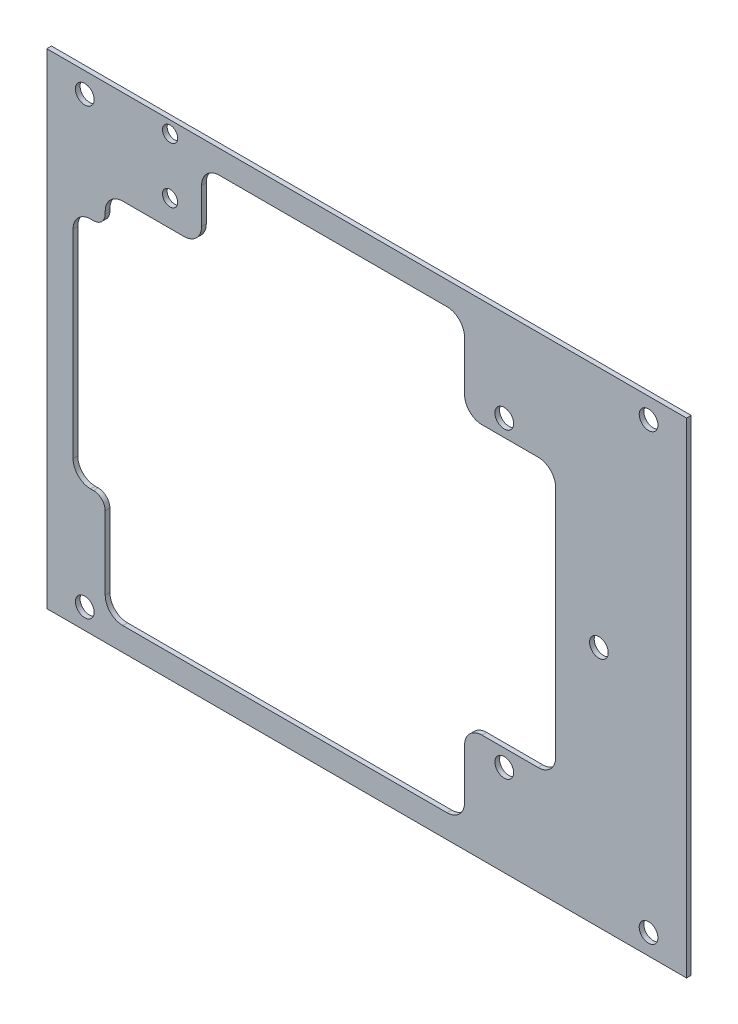
from build123d import *

# Parameters (mm, degrees)
SKETCH1_W           = 109.5
SKETCH1_H           = 83
SKETCH1_R           = 1.6
SKETCH1_R_2         = 1.3
BOSS_EXTRUDE1_DEPTH = 0.8
FILLET1_R           = 3
FILLET2_R           = 2


with BuildPart() as part:
    # Sketch1 → Boss-Extrude1 (new body)
    with BuildSketch(Plane.XY):
        with Locations((0, -41.5)):
            Rectangle(SKETCH1_W, SKETCH1_H)
        with Locations((23.55, -67.375)):
            Circle(SKETCH1_R, mode=Mode.SUBTRACT)
        with Locations((23.55, -15.625)):
            Circle(SKETCH1_R, mode=Mode.SUBTRACT)
        with Locations((48.25, -3.5)):
            Circle(SKETCH1_R, mode=Mode.SUBTRACT)
        with Locations((48.25, -79.5)):
            Circle(SKETCH1_R, mode=Mode.SUBTRACT)
        with Locations((-48.25, -79.5)):
            Circle(SKETCH1_R, mode=Mode.SUBTRACT)
        with Locations((-48.25, -3.5)):
            Circle(SKETCH1_R, mode=Mode.SUBTRACT)
        with Locations((-33.65, -2.07)):
            Circle(SKETCH1_R_2, mode=Mode.SUBTRACT)
        with Locations((-33.65, -11.6)):
            Circle(SKETCH1_R_2, mode=Mode.SUBTRACT)
        with Locations((39.75, -41.5)):
            Circle(SKETCH1_R, mode=Mode.SUBTRACT)
        Polygon((-50.25, -41.5), (-50.25, -61.5), (-44.75, -61.5), (-44.75, -79), (16.75, -79), (16.75, -64.5), (32.35, -64.5), (32.35, -18.5), (16.75, -18.5), (16.75, -4), (-28.25, -4), (-28.25, -16.1), (-44.75, -16.1), (-44.75, -21.5), (-50.25, -21.5), align=None, mode=Mode.SUBTRACT)
    extrude(amount=BOSS_EXTRUDE1_DEPTH)

    # Fillet1
    fillet1_edges = [part.edges().sort_by_distance(p)[0] for p in [
        (32.35, -64.5, 0.4),
        (32.35, -18.5, 0.4),
        (16.75, -18.5, 0.4),
        (16.75, -4, 0.4),
        (-28.25, -4, 0.4),
        (-28.25, -16.1, 0.4),
        (-44.75, -16.1, 0.4),
        (-50.25, -21.5, 0.4),
        (-50.25, -61.5, 0.4),
        (-44.75, -79, 0.4),
        (16.75, -79, 0.4),
        (16.75, -64.5, 0.4),
    ]]
    fillet(fillet1_edges, radius=FILLET1_R)

    # Fillet2
    fillet2_edges = [part.edges().sort_by_distance(p)[0] for p in [
        (-44.75, -21.5, 0.4),
        (-44.75, -61.5, 0.4),
    ]]
    fillet(fillet2_edges, radius=FILLET2_R)


solid = part.part
